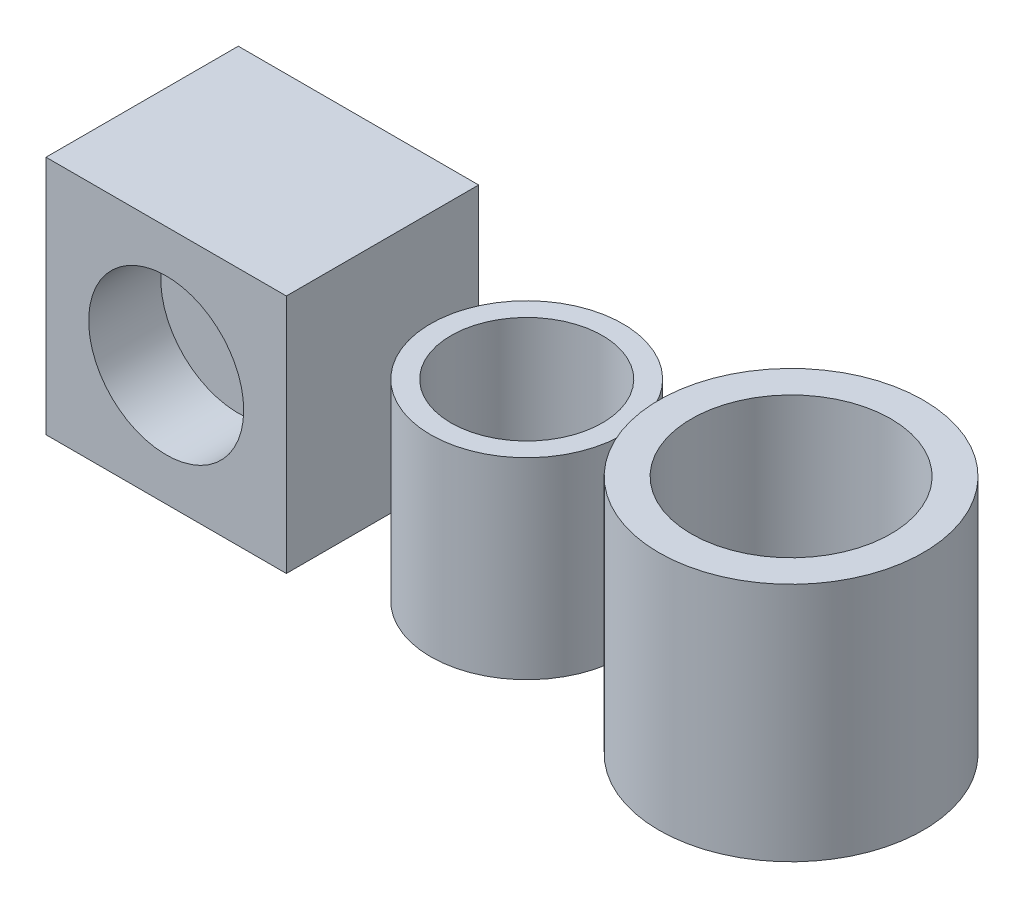
from build123d import *

# Parameters (mm, degrees)
SKETCH1_R           = 4
SKETCH1_R_2         = 3.15
BOSS_EXTRUDE1_DEPTH = 8
SKETCH2_R           = 5.5
SKETCH2_R_2         = 4.15
BOSS_EXTRUDE2_DEPTH = 10
SKETCH3_W           = 10
SKETCH3_H           = 10
BOSS_EXTRUDE3_DEPTH = 4
SKETCH4_R           = 3.225
CUT_EXTRUDE1_DEPTH  = 3


with BuildPart() as part:
    # Sketch1 → Boss-Extrude1 (new body)
    with BuildSketch(Plane(origin=(0, 0, 0), x_dir=(1, 0, 0), z_dir=(0, 1, 0))):
        with Locations(Location((0, 0, 0), (0, 0, 270))):
            Circle(SKETCH1_R)
        with Locations(Location((0, 0, 0), (0, 0, 270))):
            Circle(SKETCH1_R_2, mode=Mode.SUBTRACT)
    extrude(amount=BOSS_EXTRUDE1_DEPTH)


with BuildPart() as body_2:
    # Sketch2 → Boss-Extrude2 (new body)
    with BuildSketch(Plane(origin=(0, 0, 0), x_dir=(1, 0, 0), z_dir=(0, 1, 0))):
        with Locations(Location((11, 0, 0), (0, 0, 270))):
            Circle(SKETCH2_R)
        with Locations(Location((11, 0, 0), (0, 0, 270))):
            Circle(SKETCH2_R_2, mode=Mode.SUBTRACT)
    extrude(amount=BOSS_EXTRUDE2_DEPTH)


with BuildPart() as body_3:
    # Sketch3 → Boss-Extrude3 (new, symmetric)
    with BuildSketch(Plane.XY):
        with Locations((-11, 5)):
            Rectangle(SKETCH3_W, SKETCH3_H)
    extrude(amount=BOSS_EXTRUDE3_DEPTH, both=True)

    # Sketch4 → Cut-Extrude1 (cut)
    with BuildSketch(Plane.XY.offset(4)):
        with Locations((-11, 5)):
            Circle(SKETCH4_R)
    extrude(amount=-CUT_EXTRUDE1_DEPTH, mode=Mode.SUBTRACT)


solid = Compound([part.part, body_2.part, body_3.part])
